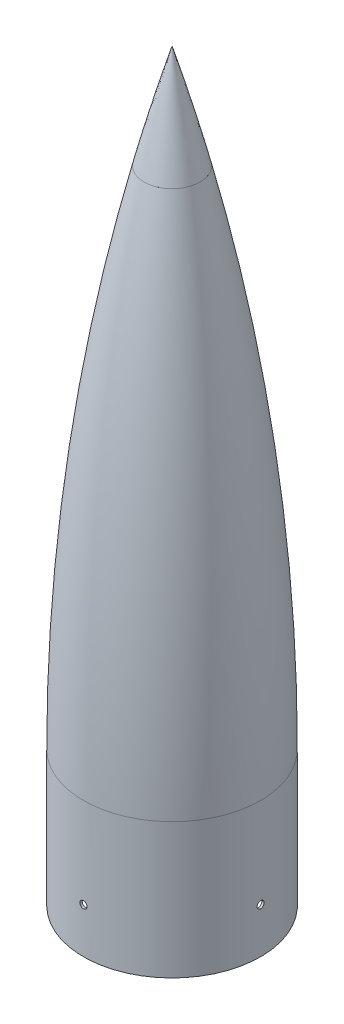
from build123d import *

# Parameters (mm, degrees)
SKETCH5_R          = 1.984375
CUT_EXTRUDE1_DEPTH = 12.7
CIRPATTERN1_COUNT  = 4


with BuildPart() as part:
    # Sketch1 → Revolve4 (revolve)
    with BuildSketch(Plane.XY, mode=Mode.PRIVATE) as revolve4_sk:
        with BuildLine():
            Line((-49.8856, 76.2), (-49.8856, 0))
            Line((-49.8856, 0), (-48.6156, 0))
            Line((-48.6156, 0), (-48.6156, 76.2))
            ThreePointArc((-48.6156, 76.2), (-40.049005617, 219.460865893), (-14.47131225, 360.68))
            Line((-14.47131225, 360.68), (-15.778396484, 360.68))
            ThreePointArc((-15.778396484, 360.68), (-41.328375548, 219.458657445), (-49.8856, 76.2))
        make_face()
    revolve(revolve4_sk.sketch.rotate(Axis((0, 0, 0), (0, 1, 0)), 270), axis=Axis((0, 0, 0), (0, 1, 0)))

    # Sketch5 → Cut-Extrude1 (cut)
    with BuildSketch(Plane(origin=(-80.274174728, -85.965568301, 50.8), x_dir=(1, 0, 0), z_dir=(0, 0, 1))):
        with Locations((80.274174728, 111.365568301)):
            Circle(SKETCH5_R)
    cut_extrude1 = extrude(amount=-CUT_EXTRUDE1_DEPTH, mode=Mode.SUBTRACT)

    # CirPattern1: Cut-Extrude1 ×4 about axis
    cirpattern1_axis = Axis((0, 0, 0), (0, -1, 0))
    for i in range(1, CIRPATTERN1_COUNT):
        add(cut_extrude1.rotate(cirpattern1_axis, i * 360 / CIRPATTERN1_COUNT), mode=Mode.SUBTRACT)


with BuildPart() as body_2:
    # Sketch4 → Revolve5 (revolve)
    with BuildSketch(Plane.XY, mode=Mode.PRIVATE) as revolve5_sk:
        with BuildLine():
            Line((0, 360.68), (0, 419.1))
            ThreePointArc((0, 419.1), (-8.256451028, 389.989189662), (-15.778396484, 360.68))
            Line((-15.778396484, 360.68), (0, 360.68))
        make_face()
    revolve(revolve5_sk.sketch.rotate(Axis((0, 360.68, 0), (0, 1, 0)), 270), axis=Axis((0, 360.68, 0), (0, 1, 0)))


solid = Compound([part.part, body_2.part])
